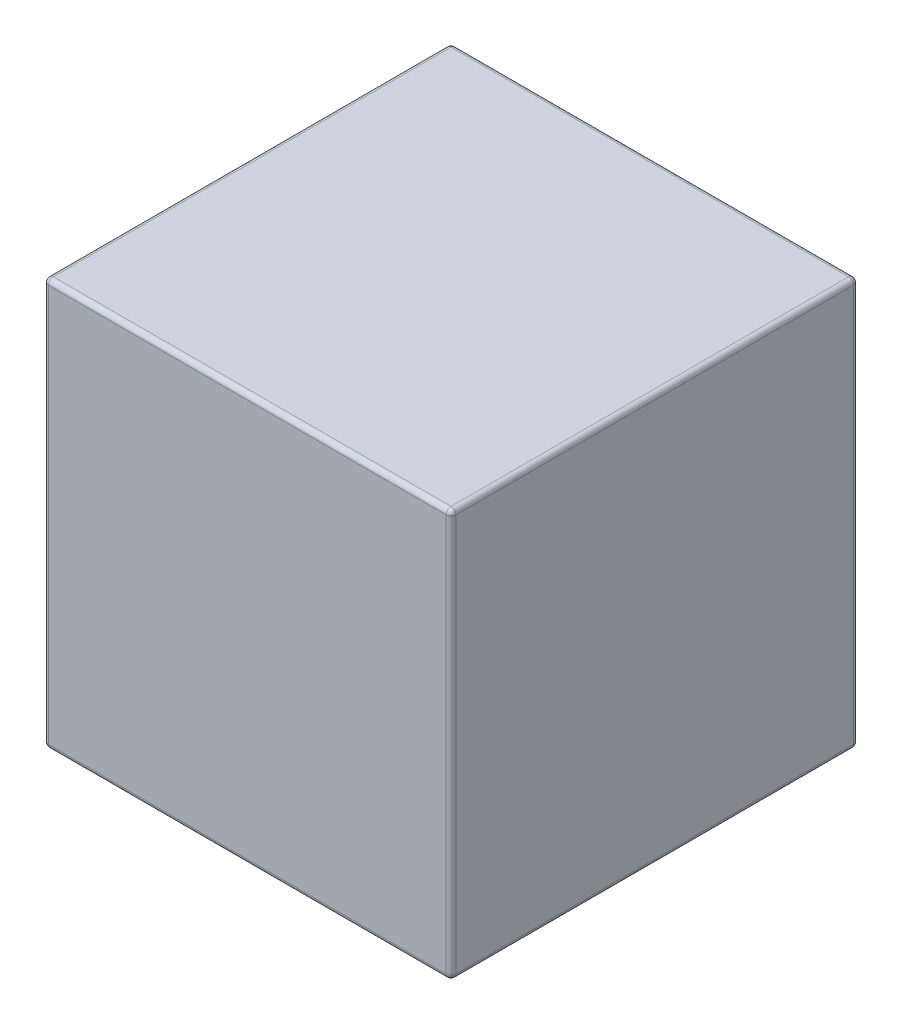
from build123d import *

# Parameters (mm, degrees)
ESQUISSE1_W             = 42
ESQUISSE1_H             = 42
BOSS_EXTRU_1_DEPTH      = 42
ESQUISSE2_W             = 10.5
ESQUISSE2_H             = 10.5
ENL_V_MAT_EXTRU_1_DEPTH = 4.5
CONG_1_R                = 0.5


with BuildPart() as part:
    # Esquisse1 → Boss.-Extru.1 (new body)
    with BuildSketch(Plane.XY):
        with Locations((21, -21)):
            Rectangle(ESQUISSE1_W, ESQUISSE1_H)
    extrude(amount=BOSS_EXTRU_1_DEPTH)

    # Esquisse2 → Enlèv. mat.-Extru.1 (cut)
    with BuildSketch(Plane.XZ.offset(42)):
        with Locations((33, 33)):
            Rectangle(ESQUISSE2_W, ESQUISSE2_H)
        with Locations((33, 9)):
            Rectangle(ESQUISSE2_W, ESQUISSE2_H)
    enl_v_mat_extru_1 = extrude(amount=-ENL_V_MAT_EXTRU_1_DEPTH, mode=Mode.SUBTRACT)

    # Congé1
    cong_1_edges = [part.edges().sort_by_distance(p)[0] for p in [
        (42, -21, 42),
        (21, 0, 42),
        (0, -21, 42),
        (21, 0, 0),
        (42, -21, 0),
        (21, -42, 0),
        (0, -21, 0),
        (21, -42, 42),
        (0, 0, 21),
        (42, 0, 21),
        (42, -42, 21),
        (0, -42, 21),
    ]]
    fillet(cong_1_edges, radius=CONG_1_R)

    # Symétrie1: Enlèv. mat.-Extru.1 across plane
    add(enl_v_mat_extru_1.mirror(Plane(origin=(21, 0, 0), x_dir=(0, 0, 1), z_dir=(1, 0, 0))), mode=Mode.SUBTRACT)


solid = part.part
